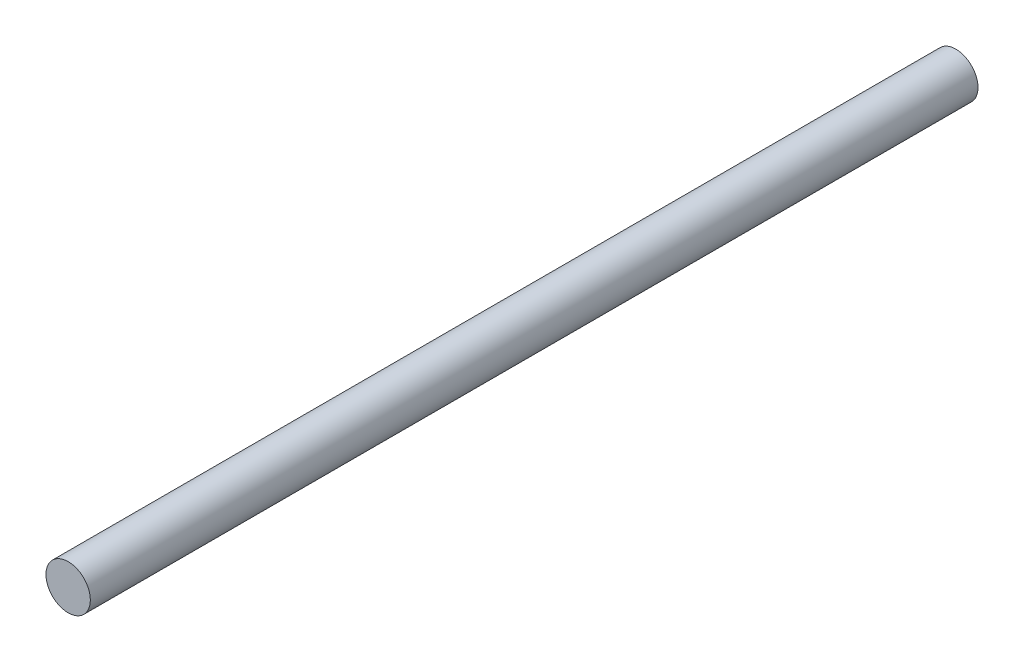
from build123d import *

# Parameters (mm, degrees)
ESQUISSE1_R        = 2.5
BOSS_EXTRU_1_DEPTH = 100


with BuildPart() as part:
    # Esquisse1 → Boss.-Extru.1 (new body)
    with BuildSketch(Plane.XY):
        Circle(ESQUISSE1_R)
    extrude(amount=BOSS_EXTRU_1_DEPTH)


solid = part.part
